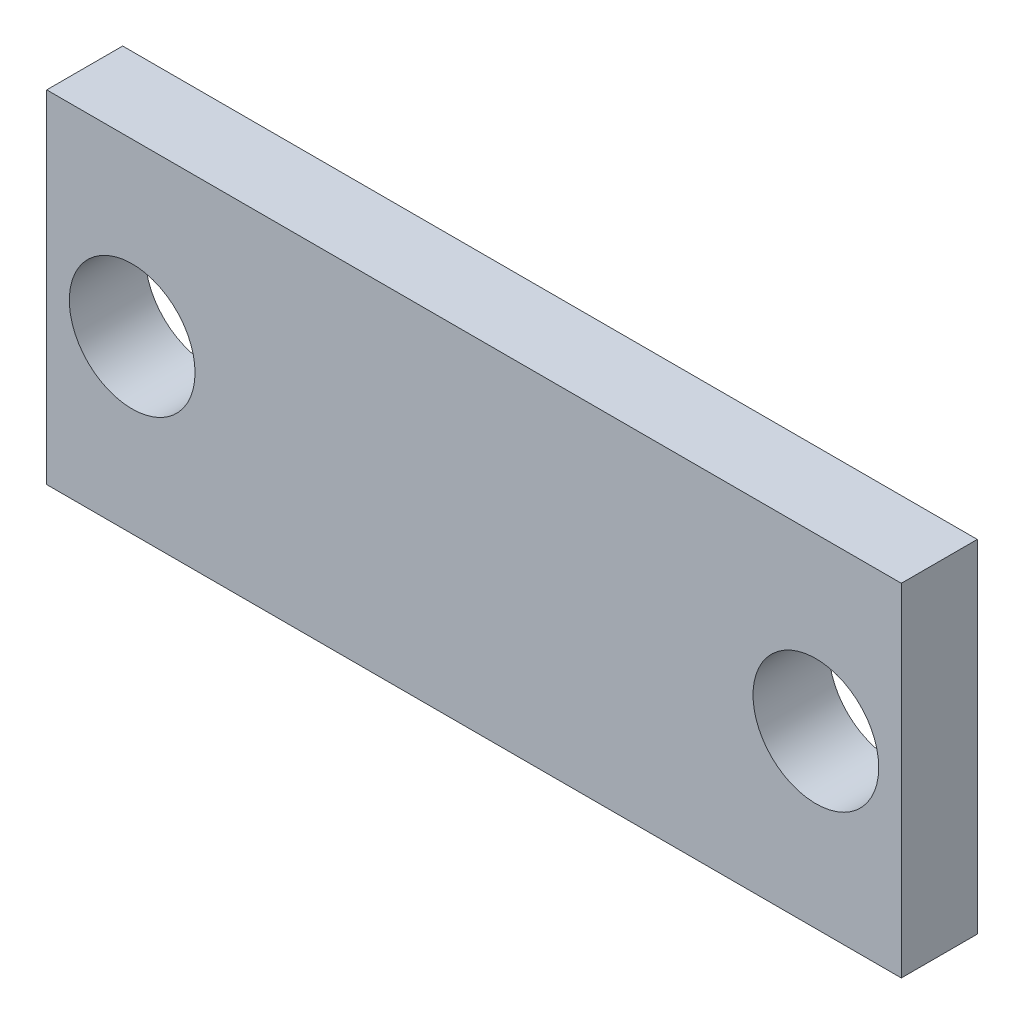
from build123d import *

# Parameters (mm, degrees)
SKETCH1_W           = 22.5
SKETCH1_H           = 9
SKETCH1_R           = 1.655
BOSS_EXTRUDE1_DEPTH = 2


with BuildPart() as part:
    # Sketch1 → Boss-Extrude1 (new body)
    with BuildSketch(Plane.XY):
        with Locations((0.628172589, 10.11928934)):
            Rectangle(SKETCH1_W, SKETCH1_H)
        with Locations((-8.371827411, 10.122666318)):
            Circle(SKETCH1_R, mode=Mode.SUBTRACT)
        with Locations((9.628172589, 10.122666318)):
            Circle(SKETCH1_R, mode=Mode.SUBTRACT)
    extrude(amount=BOSS_EXTRUDE1_DEPTH)


solid = part.part
